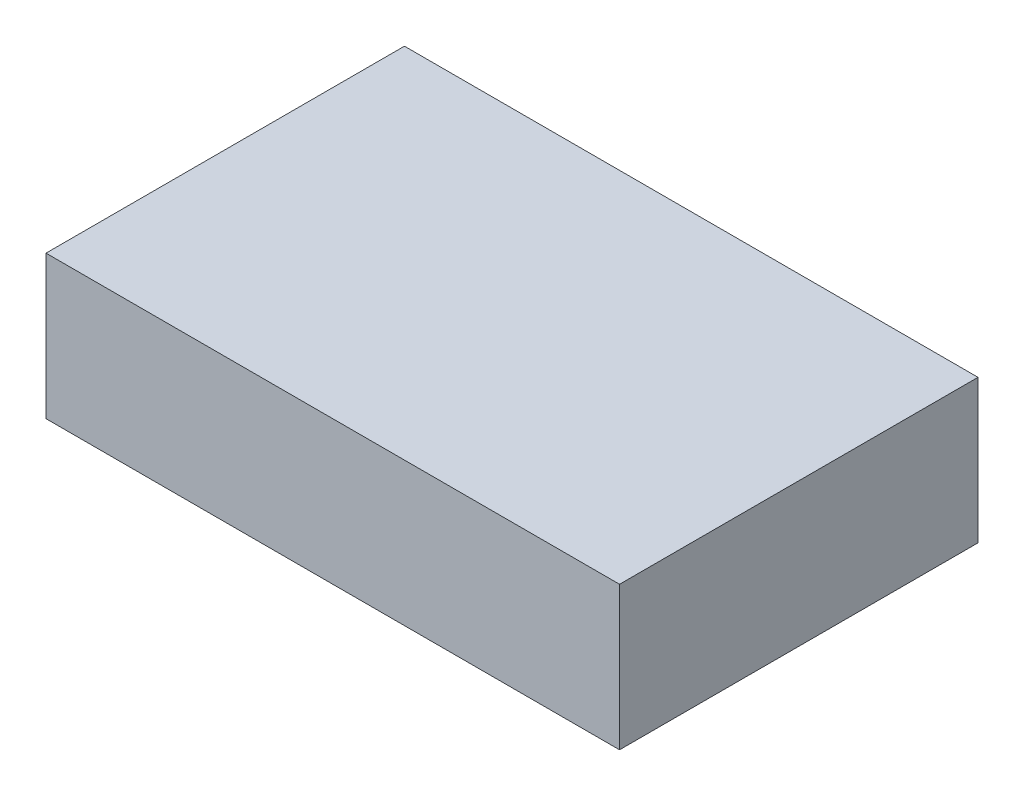
from build123d import *

# Parameters (mm, degrees)
SKETCH1_W           = 40
SKETCH1_H           = 25
BOSS_EXTRUDE1_DEPTH = 10


with BuildPart() as part:
    # Sketch1 → Boss-Extrude1 (new body)
    with BuildSketch(Plane(origin=(0, 0, 0), x_dir=(1, 0, 0), z_dir=(0, 1, 0))):
        Rectangle(SKETCH1_W, SKETCH1_H)
    extrude(amount=BOSS_EXTRUDE1_DEPTH)


solid = part.part
